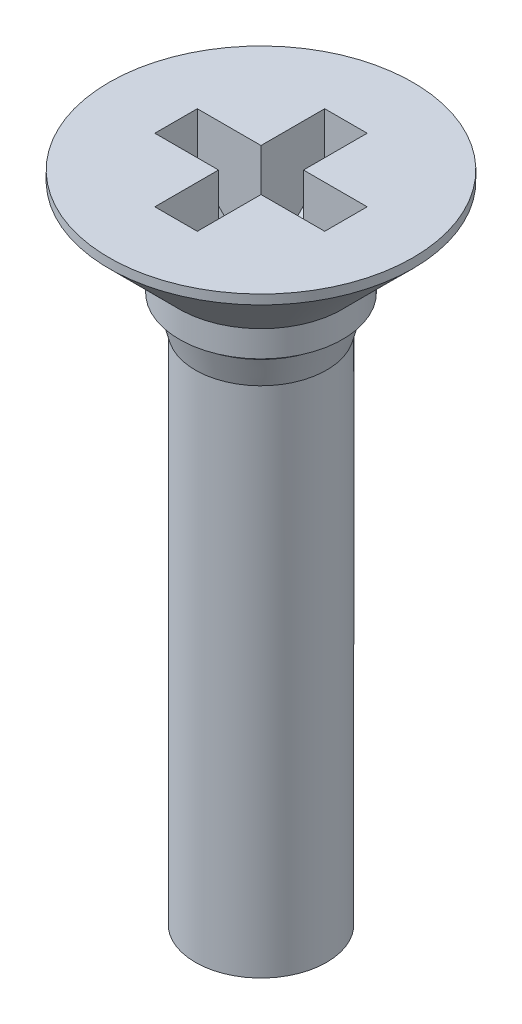
from build123d import *

# Parameters (mm, degrees)
KREUZSCHLITZ1_H_DEPTH      = 0.65
KREUZSCHLITZ1_H_DEPTH_BACK = 0.65
KREUZSCHLITZ2_H_DEPTH      = 0.65
KREUZSCHLITZ2_H_DEPTH_BACK = 0.65
BOSS_EXTRUDE1_START        = 4
SKETCH1_R                  = 2.0095
BOSS_EXTRUDE1_DEPTH        = 4


with BuildPart() as part:
    # Skizze1 → Basis-Rotation (revolve)
    with BuildSketch(Plane.XY, mode=Mode.PRIVATE) as basis_rotation_sk:
        Polygon((0, 0), (4.65, 0), (4.65, -0.29), (2.5, -2.44), (2.5, -3.24), (2.24, -3.24), (2.24, -3.439762289), (2.0095, -4.3), (2.0095, -16), (0, -16), align=None)
    revolve(basis_rotation_sk.sketch.rotate(Axis((0, 0, 0), (0, -1, 0)), 180), axis=Axis((0, 0, 0), (0, -1, 0)))

    # Skizze2 → Kreuzschlitz1 H (cut, two sides: drawn at the far end of the back side and taken through both)
    with BuildSketch(Plane.XY.offset(-KREUZSCHLITZ1_H_DEPTH_BACK)):
        Polygon((-1, -3.2), (1, -3.2), (2.6, -1.6), (2.6, 0), (-2.6, 0), (-2.6, -1.6), align=None)
    extrude(amount=KREUZSCHLITZ1_H_DEPTH + KREUZSCHLITZ1_H_DEPTH_BACK, mode=Mode.SUBTRACT)

    # Skizze3 → Kreuzschlitz2 H (cut, two sides: drawn at the far end of the back side and taken through both)
    with BuildSketch(Plane(origin=(0, 0, 0), x_dir=(0, 0, -1), z_dir=(1, 0, 0)).offset(-KREUZSCHLITZ2_H_DEPTH_BACK)):
        Polygon((-1, -3.2), (1, -3.2), (2.6, -1.6), (2.6, 0), (-2.6, 0), (-2.6, -1.6), align=None)
    extrude(amount=KREUZSCHLITZ2_H_DEPTH + KREUZSCHLITZ2_H_DEPTH_BACK, mode=Mode.SUBTRACT)

    # Sketch1 → Boss-Extrude1 (add)
    with BuildSketch(Plane.XZ.offset(16).offset(BOSS_EXTRUDE1_START)):
        with Locations(Location((0, 0, 0), (0, 0, 180))):
            Circle(SKETCH1_R)
    extrude(amount=-BOSS_EXTRUDE1_DEPTH)


solid = part.part
